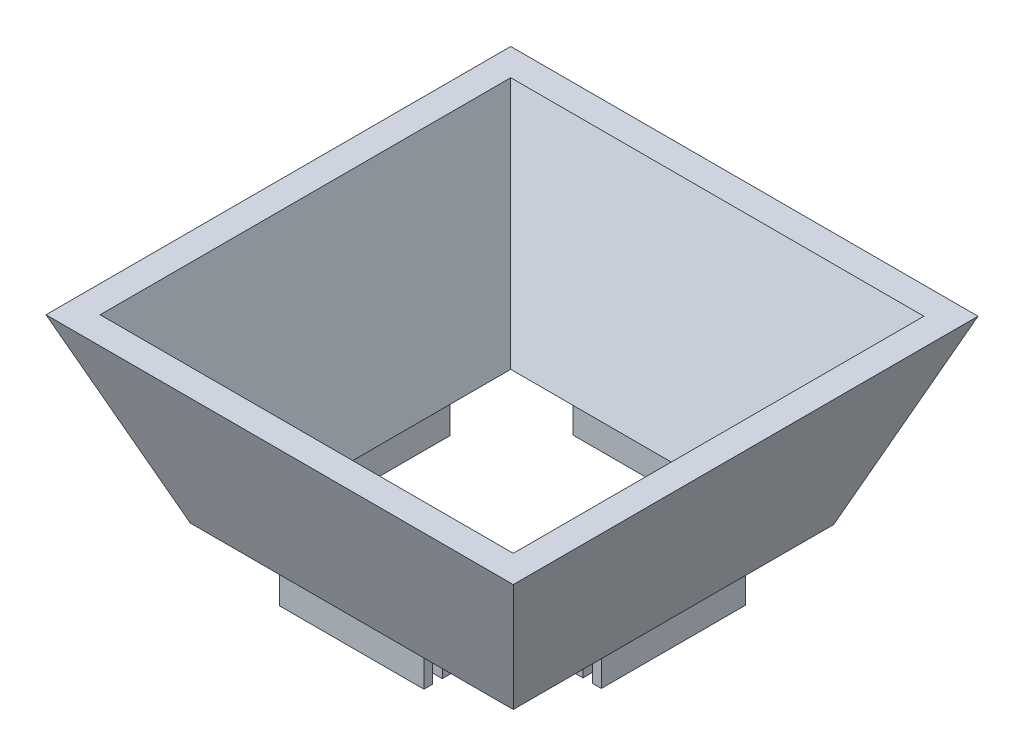
from build123d import *

# Parameters (mm, degrees)
SKETCH5_W           = 6.1595
SKETCH5_H           = 101.6
SKETCH5_W_2         = 101.6
SKETCH5_H_2         = 6.1595
BOSS_EXTRUDE1_DEPTH = 19.05


with BuildPart() as part:
    # Sketch2 → Loft1 section 0
    with BuildSketch(Plane(origin=(0, 127, 0), x_dir=(1, 0, 0), z_dir=(0, 1, 0))):
        with BuildLine():
            Line((-50.8, -50.8), (278.13, -50.8))
            Line((278.13, -50.8), (278.13, 276.352))
            Line((278.13, 276.352), (-50.8, 276.352))
            Line((-50.8, 276.352), (-50.8, -50.8))
        make_face()
    # Sketch1 → Loft1 section 1
    with BuildSketch(Plane(origin=(0, 0, 0), x_dir=(1, 0, 0), z_dir=(0, 1, 0))):
        with BuildLine():
            Line((0, 0), (227.33, 0))
            Line((227.33, 0), (227.33, 225.552))
            Line((227.33, 225.552), (0, 225.552))
            Line((0, 225.552), (0, 0))
        make_face()
    loft()

    # Sketch4 → Cut-Loft3 section 0
    with BuildSketch(Plane.XZ):
        with BuildLine():
            Line((208.28, -19.05), (19.05, -19.05))
            Line((19.05, -19.05), (19.05, -206.502))
            Line((19.05, -206.502), (208.28, -206.502))
            Line((208.28, -206.502), (208.28, -19.05))
        make_face()
    # Sketch3 → Cut-Loft3 section 1
    with BuildSketch(Plane(origin=(0, 127, 0), x_dir=(1, 0, 0), z_dir=(0, 1, 0))):
        with BuildLine():
            Line((-31.75, 257.302), (-31.75, -31.75))
            Line((-31.75, -31.75), (259.08, -31.75))
            Line((259.08, -31.75), (259.08, 257.302))
            Line((259.08, 257.302), (-31.75, 257.302))
        make_face()
    loft(mode=Mode.SUBTRACT)

    # Sketch5 → Boss-Extrude1 (add)
    with BuildSketch(Plane.XZ):
        with Locations((3.07975, -112.776)):
            Rectangle(SKETCH5_W, SKETCH5_H)
        with Locations((15.97025, -112.776)):
            Rectangle(SKETCH5_W, SKETCH5_H)
        with Locations((113.665, -3.07975)):
            Rectangle(SKETCH5_W_2, SKETCH5_H_2)
        with Locations((113.665, -15.97025)):
            Rectangle(SKETCH5_W_2, SKETCH5_H_2)
        with Locations((223.36125, -113.665)):
            Rectangle(SKETCH5_W, SKETCH5_H)
        with Locations((210.47075, -113.665)):
            Rectangle(SKETCH5_W, SKETCH5_H)
        with Locations((112.776, -223.36125)):
            Rectangle(SKETCH5_W_2, SKETCH5_H_2)
        with Locations((112.776, -210.47075)):
            Rectangle(SKETCH5_W_2, SKETCH5_H_2)
    extrude(amount=BOSS_EXTRUDE1_DEPTH)


solid = part.part
